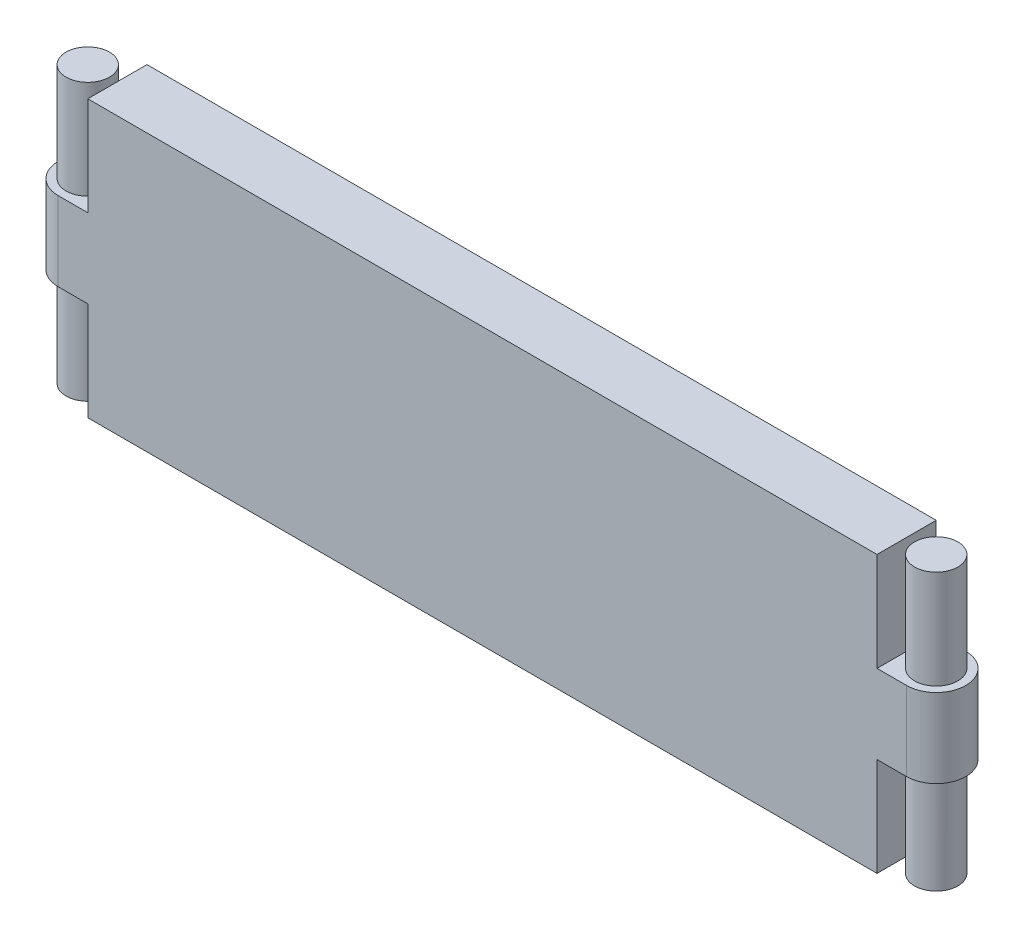
from build123d import *

# Parameters (mm, degrees)
PLATE_SKETCH_W            = 200
PLATE_SKETCH_H            = 70
PLATE_EXTRUDE_DEPTH       = 15
HINGE_PLATE_EXTRUDE_DEPTH = 10
PIN_SKETCH_R              = 5.5
UPPER_PIN_EXTRUDE_DEPTH   = 25
LOWER_START               = -45
PIN_SKETCH_2_R            = 5.5
LOWER_PIN_EXTRUDE_DEPTH   = 25


with BuildPart() as part:
    # Plate Sketch → Plate Extrude (new body)
    with BuildSketch(Plane.XY):
        Rectangle(PLATE_SKETCH_W, PLATE_SKETCH_H)
    extrude(amount=-PLATE_EXTRUDE_DEPTH)

    # Hinge Plate Sketch → Hinge Plate Extrude (add, symmetric)
    with BuildSketch(Plane(origin=(0, 0, 0), x_dir=(1, 0, 0), z_dir=(0, 1, 0))):
        with BuildLine():
            Line((100, 15), (107.5, 15))
            ThreePointArc((107.5, 15), (115, 7.5), (107.5, 0))
            Line((107.5, 0), (100, 0))
            Line((100, 0), (100, 15))
        make_face()
    hinge_plate_extrude = extrude(amount=HINGE_PLATE_EXTRUDE_DEPTH, both=True)

    # Pin Sketch → Upper Pin Extrude (add)
    with BuildSketch(Plane(origin=(0, 10, 0), x_dir=(1, 0, 0), z_dir=(0, 1, 0))):
        with Locations(Location((107.5, 7.5, 0), (0, 0, 270))):
            Circle(PIN_SKETCH_R)
    upper_pin_extrude = extrude(amount=UPPER_PIN_EXTRUDE_DEPTH)

    # Pin Sketch<2> → Lower Pin Extrude (add)
    with BuildSketch(Plane(origin=(0, 10, 0), x_dir=(1, 0, 0), z_dir=(0, 1, 0)).offset(LOWER_START)):
        with Locations(Location((107.5, 7.5, 0), (0, 0, 270))):
            Circle(PIN_SKETCH_2_R)
    lower_pin_extrude = extrude(amount=LOWER_PIN_EXTRUDE_DEPTH)

    # Hinge Mirror: Hinge Plate Extrude, Upper Pin Extrude, Lower Pin Extrude across plane
    add(hinge_plate_extrude.mirror(Plane(origin=(0, 0, 0), x_dir=(0, 0, 1), z_dir=(1, 0, 0))))
    add(upper_pin_extrude.mirror(Plane(origin=(0, 0, 0), x_dir=(0, 0, 1), z_dir=(1, 0, 0))))
    add(lower_pin_extrude.mirror(Plane(origin=(0, 0, 0), x_dir=(0, 0, 1), z_dir=(1, 0, 0))))


solid = part.part
